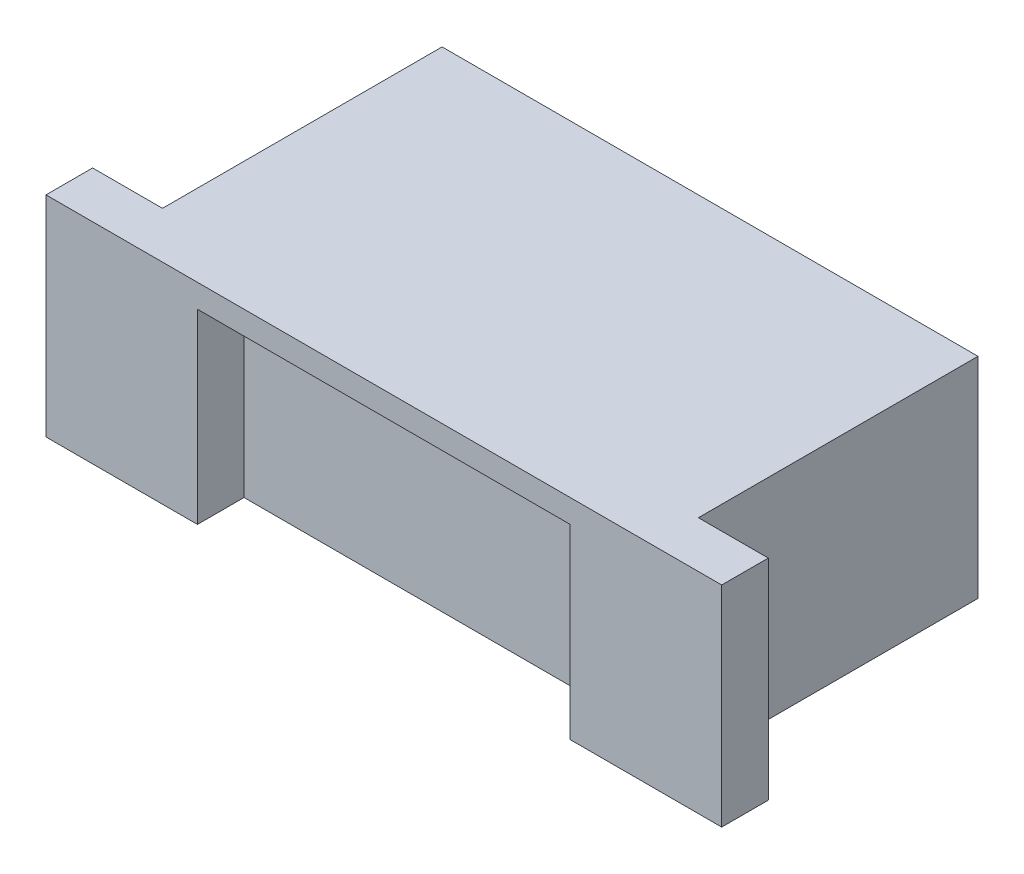
from build123d import *

# Parameters (mm, degrees)
BOSS_EXTRUDE1_DEPTH = 2.25
SKETCH2_W           = 4
SKETCH2_H           = 2
CUT_EXTRUDE1_DEPTH  = 0.5


with BuildPart() as part:
    # Sketch1 → Boss-Extrude1 (new body)
    with BuildSketch(Plane(origin=(0, 0, 0), x_dir=(1, 0, 0), z_dir=(0, 1, 0))):
        Polygon((0, 0), (7.25, 0), (7.25, 0.5), (6.5, 0.5), (6.5, 3.5), (0.75, 3.5), (0.75, 0.5), (0, 0.5), align=None)
    extrude(amount=BOSS_EXTRUDE1_DEPTH)

    # Sketch2 → Cut-Extrude1 (cut)
    with BuildSketch(Plane.XY):
        with Locations((3.625, 1)):
            Rectangle(SKETCH2_W, SKETCH2_H)
    extrude(amount=-CUT_EXTRUDE1_DEPTH, mode=Mode.SUBTRACT)


solid = part.part
